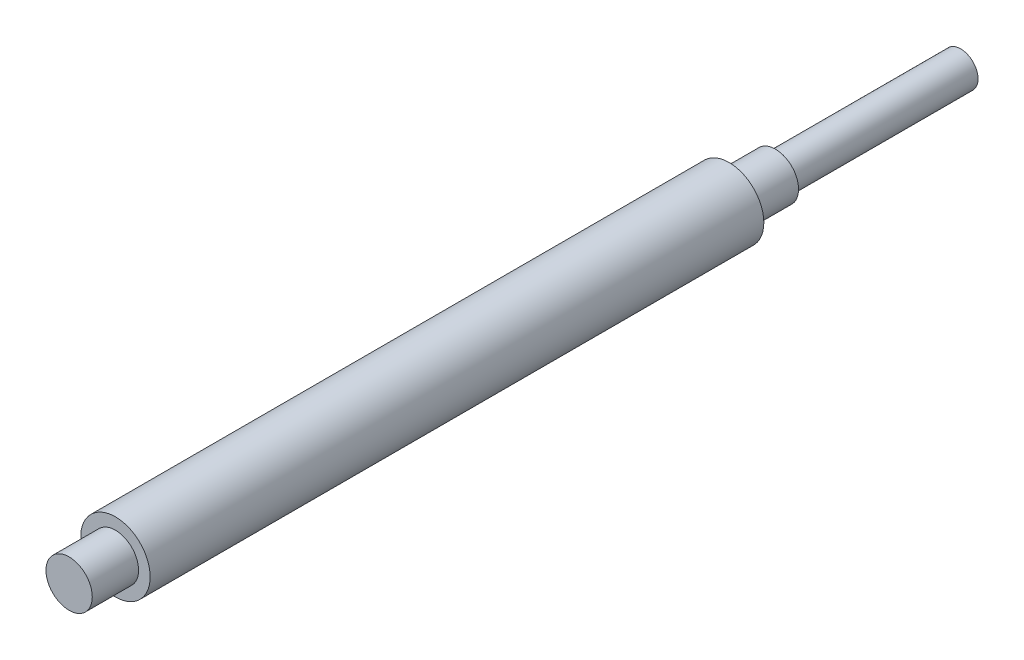
from build123d import *

# Parameters (mm, degrees)
ESBO_O1_R                = 3
RESSALTO_EXTRUS_O1_DEPTH = 77
CORTE_EXTRUS_O1_START    = -4
ESBO_O2_R                = 3
ESBO_O2_R_2              = 2
CORTE_EXTRUS_O1_DEPTH    = 4
ESBO_O3_R                = 3
ESBO_O3_R_2              = 2
CORTE_EXTRUS_O2_DEPTH    = 20
ESBO_O4_R                = 2.5
ESBO_O4_R_2              = 1.5
CORTE_EXTRUS_O3_DEPTH    = 16


with BuildPart() as part:
    # Esboço1 → Ressalto-extrusão1 (new body)
    with BuildSketch(Plane.XY):
        Circle(ESBO_O1_R)
    extrude(amount=RESSALTO_EXTRUS_O1_DEPTH)

    # Esboço2 → Corte-extrusão1 (cut)
    with BuildSketch(Plane.XY.offset(77).offset(CORTE_EXTRUS_O1_START)):
        Circle(ESBO_O2_R)
        Circle(ESBO_O2_R_2, mode=Mode.SUBTRACT)
    extrude(amount=CORTE_EXTRUS_O1_DEPTH, mode=Mode.SUBTRACT)

    # Esboço3 → Corte-extrusão2 (cut)
    with BuildSketch(Plane(origin=(0, 0, 0), x_dir=(-1, 0, 0), z_dir=(0, 0, -1))):
        with Locations(Location((0, 0, 0), (0, 0, 180))):
            Circle(ESBO_O3_R)
        with Locations(Location((0, 0, 0), (0, 0, 180))):
            Circle(ESBO_O3_R_2, mode=Mode.SUBTRACT)
    extrude(amount=-CORTE_EXTRUS_O2_DEPTH, mode=Mode.SUBTRACT)

    # Esboço4 → Corte-extrusão3 (cut)
    with BuildSketch(Plane(origin=(0, 0, 0), x_dir=(-1, 0, 0), z_dir=(0, 0, -1))):
        Circle(ESBO_O4_R)
        Circle(ESBO_O4_R_2, mode=Mode.SUBTRACT)
    extrude(amount=-CORTE_EXTRUS_O3_DEPTH, mode=Mode.SUBTRACT)


solid = part.part
